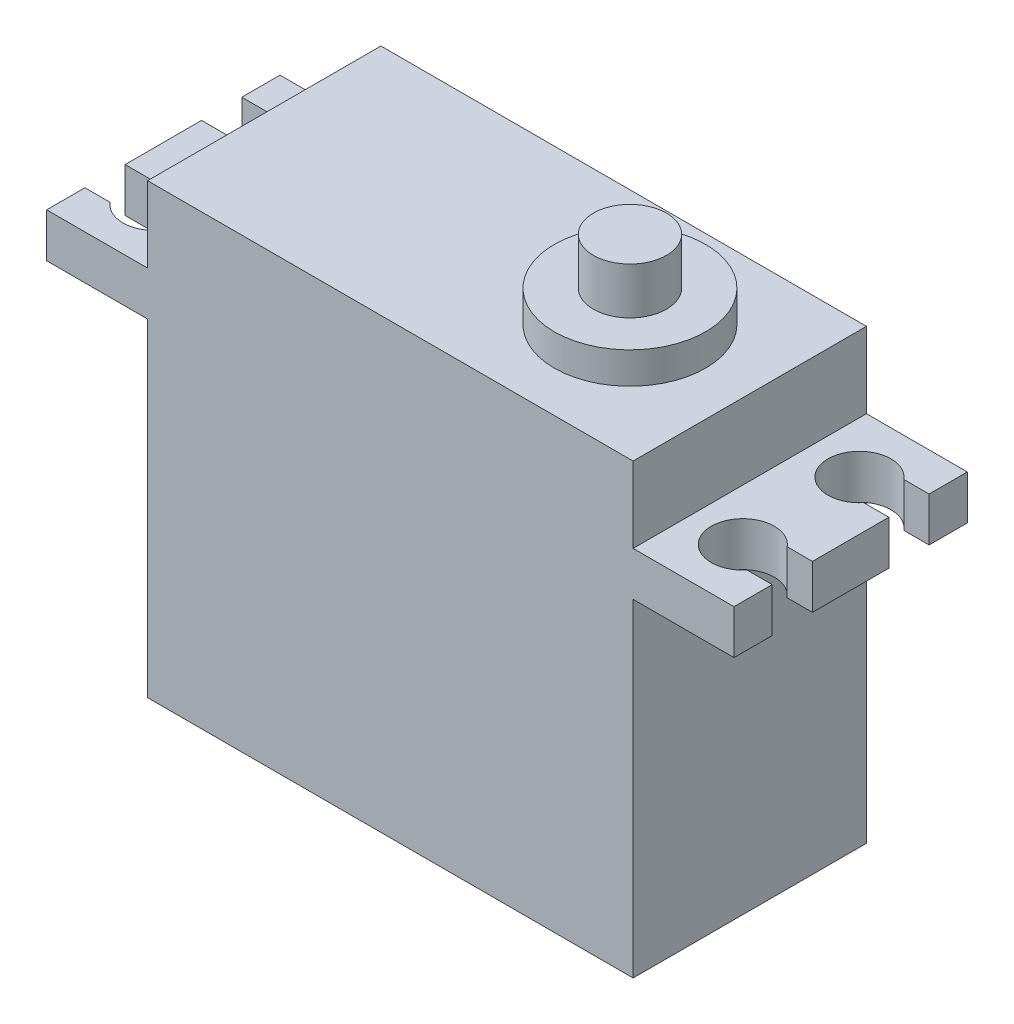
from build123d import *

# Parameters (mm, degrees)
BOSS_EXTRU_1_DEPTH      = 18.5
ENL_V_MAT_EXTRU_1_DEPTH = 58.017897583
ESQUISSE4_W             = 38.5
ESQUISSE4_H             = 18.5
BOSS_EXTRU_2_DEPTH      = 6
ESQUISSE6_R             = 6
BOSS_EXTRU_3_DEPTH      = 2.5
ESQUISSE7_R             = 2.9
BOSS_EXTRU_4_DEPTH      = 3.7


with BuildPart() as part:
    # Esquisse2 → Boss.-Extru.1 (new body)
    with BuildSketch(Plane.XY):
        Polygon((-9.349799062, -0.125566913), (-9.349799062, 3.374433087), (45.150200938, 3.374433087), (45.150200938, -0.125566913), (37.150200938, -0.125566913), (37.150200938, -26.125566913), (-1.349799062, -26.125566913), (-1.349799062, -0.125566913), align=None)
    extrude(amount=BOSS_EXTRU_1_DEPTH)

    # Esquisse3 → Enlèv. mat.-Extru.1 (cut, through all)
    with BuildSketch(Plane(origin=(0, 3.374433087, 0), x_dir=(1, 0, 0), z_dir=(0, 1, 0))):
        with BuildLine():
            Line((-9.349799062, -15.468288585), (-7.349799062, -15.468288585))
            ThreePointArc((-7.349799062, -15.468288585), (-2.923291475, -13.875), (-7.349799062, -12.281711415))
            Line((-7.349799062, -12.281711415), (-9.349799062, -12.281711415))
            Line((-9.349799062, -12.281711415), (-9.349799062, -15.468288585))
        make_face()
        with BuildLine():
            Line((45.150200938, -12.281711415), (43.150200938, -12.281711415))
            ThreePointArc((43.150200938, -12.281711415), (38.723693351, -13.875), (43.150200938, -15.468288585))
            Line((43.150200938, -15.468288585), (45.150200938, -15.468288585))
            Line((45.150200938, -15.468288585), (45.150200938, -12.281711415))
        make_face()
        with BuildLine():
            Line((-9.349799062, -6.218288585), (-7.349799062, -6.218288585))
            ThreePointArc((-7.349799062, -6.218288585), (-2.923291475, -4.625), (-7.349799062, -3.031711415))
            Line((-7.349799062, -3.031711415), (-9.349799062, -3.031711415))
            Line((-9.349799062, -3.031711415), (-9.349799062, -6.218288585))
        make_face()
        with BuildLine():
            Line((45.150200938, -3.031711415), (43.150200938, -3.031711415))
            ThreePointArc((43.150200938, -3.031711415), (38.723693351, -4.625), (43.150200938, -6.218288585))
            Line((43.150200938, -6.218288585), (45.150200938, -6.218288585))
            Line((45.150200938, -6.218288585), (45.150200938, -3.031711415))
        make_face()
    extrude(amount=-ENL_V_MAT_EXTRU_1_DEPTH, mode=Mode.SUBTRACT)

    # Esquisse4 → Boss.-Extru.2 (add)
    with BuildSketch(Plane(origin=(0, 3.374433087, 0), x_dir=(1, 0, 0), z_dir=(0, 1, 0))):
        with Locations((17.900200938, -9.25)):
            Rectangle(ESQUISSE4_W, ESQUISSE4_H)
    extrude(amount=BOSS_EXTRU_2_DEPTH)

    # Esquisse6 → Boss.-Extru.3 (add)
    with BuildSketch(Plane(origin=(0, 9.374433087, 0), x_dir=(1, 0, 0), z_dir=(0, 1, 0))):
        with Locations(Location((27.650200938, -9.25, 0), (0, 0, 270))):
            Circle(ESQUISSE6_R)
    extrude(amount=BOSS_EXTRU_3_DEPTH)

    # Esquisse7 → Boss.-Extru.4 (add)
    with BuildSketch(Plane(origin=(0, 11.874433087, 0), x_dir=(1, 0, 0), z_dir=(0, 1, 0))):
        with Locations(Location((27.650200938, -9.25, 0), (0, 0, 270))):
            Circle(ESQUISSE7_R)
    extrude(amount=BOSS_EXTRU_4_DEPTH)


solid = part.part
